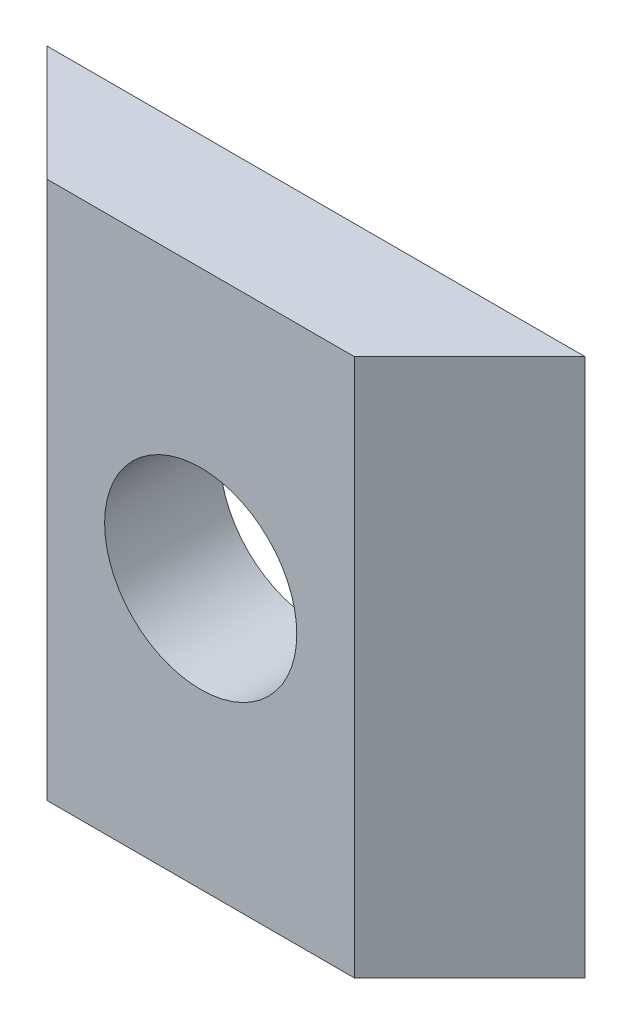
from build123d import *

# Parameters (mm, degrees)
BOSS_EXTRUDE1_DEPTH = 7
SKETCH2_R           = 2.5
CUT_EXTRUDE1_DEPTH  = 14


with BuildPart() as part:
    # Sketch1 → Boss-Extrude1 (new, symmetric)
    with BuildSketch(Plane(origin=(0, 0, 0), x_dir=(1, 0, 0), z_dir=(0, 1, 0))):
        Polygon((7, 1.5), (-7, 1.5), (-4, -1.5), (4, -1.5), align=None)
    extrude(amount=BOSS_EXTRUDE1_DEPTH, both=True)

    # Sketch2 → Cut-Extrude1 (cut)
    with BuildSketch(Plane(origin=(0, 0, -1.5), x_dir=(-1, 0, 0), z_dir=(0, 0, -1))):
        Circle(SKETCH2_R)
    extrude(amount=-CUT_EXTRUDE1_DEPTH, mode=Mode.SUBTRACT)


solid = part.part
